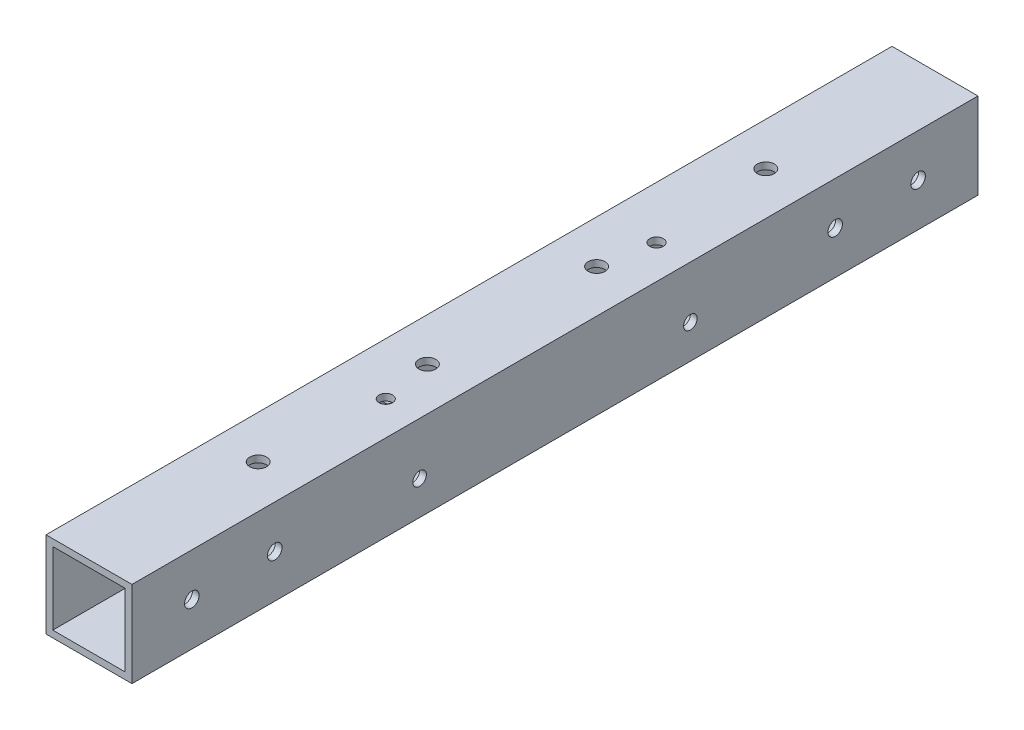
from build123d import *

# Parameters (mm, degrees)
SKETCH_1_W          = 25.4
SKETCH_1_H          = 25.4
EXTRUDE_1_DEPTH     = 250
SKETCH_1_3_W        = 21.4
SKETCH_1_3_H        = 21.4
CUT_EXTRUDE_1_DEPTH = 251.644329679
SKETCH_2_R          = 2.15
CUT_EXTRUDE_2_DEPTH = 3
SKETCH_3_R          = 2.15
CUT_EXTRUDE_3_DEPTH = 3
SKETCH_4_R          = 2.15
CUT_EXTRUDE_4_DEPTH = 3
SKETCH_5_R          = 2.150000004
CUT_EXTRUDE_5_DEPTH = 3
SKETCH_6_R          = 2.5
CUT_EXTRUDE_6_DEPTH = 10
SKETCH_7_R          = 2.5
CUT_EXTRUDE_7_DEPTH = 10
SKETCH_9_R          = 2
CUT_EXTRUDE_8_DEPTH = 25.4
SKETCH_10_R         = 2
CUT_EXTRUDE_9_DEPTH = 25.4


with BuildPart() as part:
    # 草圖1 → 填料-伸長1 (new body)
    with BuildSketch(Plane.XY):
        Rectangle(SKETCH_1_W, SKETCH_1_H)
    extrude(amount=EXTRUDE_1_DEPTH)

    # 草圖1<3> → 除料-伸長1 (cut, through all)
    with BuildSketch(Plane.XY):
        Rectangle(SKETCH_1_3_W, SKETCH_1_3_H)
    extrude(amount=CUT_EXTRUDE_1_DEPTH, mode=Mode.SUBTRACT)

    # 草圖2 → 除料-伸長2 (cut)
    with BuildSketch(Plane(origin=(12.7, 0, 0), x_dir=(0, 0, -1), z_dir=(1, 0, 0))):
        with Locations((-232.3, 0)):
            Circle(SKETCH_2_R)
        with Locations((-207.8, 0)):
            Circle(SKETCH_2_R)
    extrude(amount=-CUT_EXTRUDE_2_DEPTH, mode=Mode.SUBTRACT)

    # 草圖3 → 除料-伸長3 (cut)
    with BuildSketch(Plane.XZ.offset(12.7)):
        with Locations((0, 232.3)):
            Circle(SKETCH_3_R)
        with Locations((0, 207.8)):
            Circle(SKETCH_3_R)
    extrude(amount=-CUT_EXTRUDE_3_DEPTH, mode=Mode.SUBTRACT)

    # 草圖4 → 除料-伸長4 (cut)
    with BuildSketch(Plane(origin=(12.7, 0, 0), x_dir=(0, 0, -1), z_dir=(1, 0, 0))):
        with Locations((-42.199999985, -1e-08)):
            Circle(SKETCH_4_R)
        with Locations((-17.699999985, -1e-08)):
            Circle(SKETCH_4_R)
    extrude(amount=-CUT_EXTRUDE_4_DEPTH, mode=Mode.SUBTRACT)

    # 草圖5 → 除料-伸長5 (cut)
    with BuildSketch(Plane.XZ.offset(12.7)):
        with Locations((0, 42.199999986)):
            Circle(SKETCH_5_R)
        with Locations((0, 17.699999986)):
            Circle(SKETCH_5_R)
    extrude(amount=-CUT_EXTRUDE_5_DEPTH, mode=Mode.SUBTRACT)

    # 草圖6 → 除料-伸長6 (cut)
    with BuildSketch(Plane.ZY.offset(12.7)):
        with Locations((100, 0)):
            Circle(SKETCH_6_R)
        with Locations((150, 0)):
            Circle(SKETCH_6_R)
        with Locations((200, 0)):
            Circle(SKETCH_6_R)
        with Locations((50, 0)):
            Circle(SKETCH_6_R)
    extrude(amount=-CUT_EXTRUDE_6_DEPTH, mode=Mode.SUBTRACT)

    # 草圖7 → 除料-伸長7 (cut)
    with BuildSketch(Plane(origin=(0, 12.7, 0), x_dir=(1, 0, 0), z_dir=(0, 1, 0))):
        with Locations((0, -50)):
            Circle(SKETCH_7_R)
        with Locations((0, -100)):
            Circle(SKETCH_7_R)
        with Locations((0, -150)):
            Circle(SKETCH_7_R)
        with Locations((0, -200)):
            Circle(SKETCH_7_R)
    extrude(amount=-CUT_EXTRUDE_7_DEPTH, mode=Mode.SUBTRACT)

    # 草圖9 → 除料-伸長8 (cut)
    with BuildSketch(Plane.XZ.offset(12.7)):
        with Locations((2.7, 165)):
            Circle(SKETCH_9_R)
        with Locations((2.7, 85)):
            Circle(SKETCH_9_R)
    extrude(amount=-CUT_EXTRUDE_8_DEPTH, mode=Mode.SUBTRACT)

    # 草圖10 → 除料-伸長9 (cut)
    with BuildSketch(Plane(origin=(12.7, 0, 0), x_dir=(0, 0, -1), z_dir=(1, 0, 0))):
        with Locations((-85, -2.7)):
            Circle(SKETCH_10_R)
        with Locations((-165, -2.7)):
            Circle(SKETCH_10_R)
    extrude(amount=-CUT_EXTRUDE_9_DEPTH, mode=Mode.SUBTRACT)


solid = part.part
